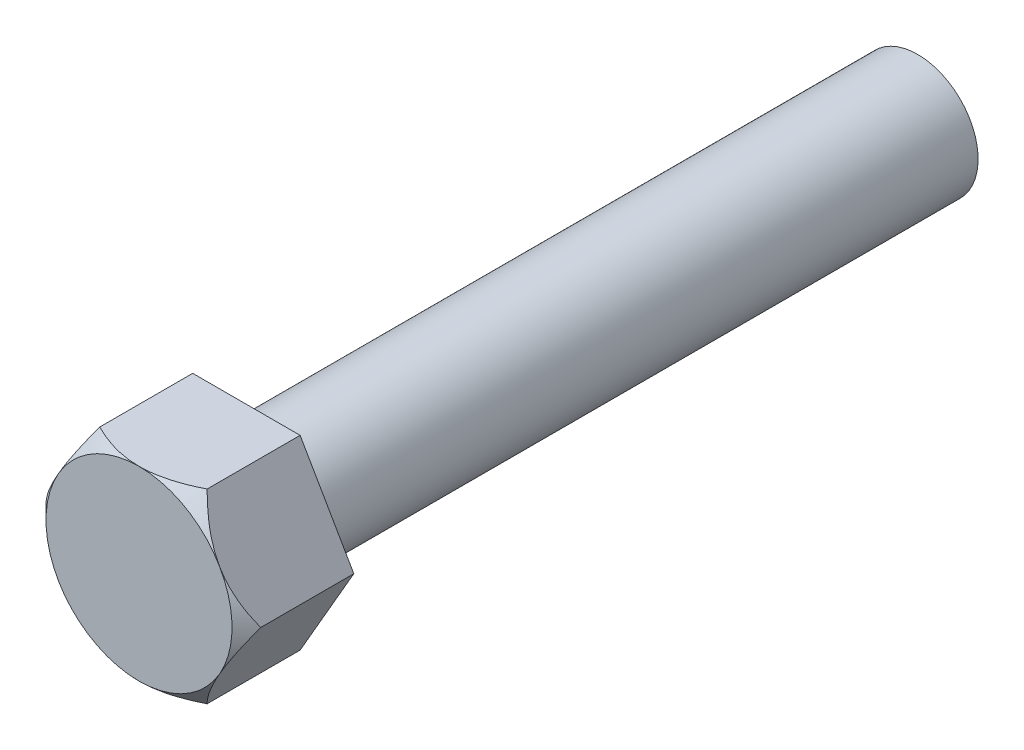
from build123d import *

# Parameters (mm, degrees)
BOSS_EXTRUDE1_DEPTH = 4
SKETCH2_OUTSIDE_W   = 20.262
SKETCH2_OUTSIDE_H   = 19.19
SKETCH2_OUTSIDE_R   = 3.464101615
CUT_EXTRUDE1_DEPTH  = 4
CUT_EXTRUDE1_DRAFT  = -45
SKETCH3_R           = 2.25
BOSS_EXTRUDE2_DEPTH = 25


with BuildPart() as part:
    # Sketch1 → Boss-Extrude1 (new body)
    with BuildSketch(Plane.XY):
        Polygon((-2, 3.464101615), (-4, 0), (-2, -3.464101615), (2, -3.464101615), (4, 0), (2, 3.464101615), align=None)
    extrude(amount=BOSS_EXTRUDE1_DEPTH)


with BuildPart() as cut_extrude1_tool:
    # Sketch2 outside → Cut-Extrude1 (with draft: the straight prism first)
    with BuildSketch(Plane.XY.offset(4)):
        Rectangle(SKETCH2_OUTSIDE_W, SKETCH2_OUTSIDE_H)
        Circle(SKETCH2_OUTSIDE_R, mode=Mode.SUBTRACT)
    extrude(amount=-CUT_EXTRUDE1_DEPTH)
    # Cut-Extrude1: the draft: its side faces are tilted about the plane it starts from
    cut_extrude1_sides = [cut_extrude1_tool.faces().sort_by_distance(p)[0] for p in [
        (0, -9.595, 2),
        (10.131, 0, 2),
        (0, 9.595, 2),
        (-10.131, 0, 2),
        (-3.464101615, 0, 2),
    ]]
    draft(cut_extrude1_sides, Plane.XY.offset(4), CUT_EXTRUDE1_DRAFT)


with BuildPart() as part_1:
    add(part.part)

    # Cut-Extrude1: cut by cut_extrude1_tool
    add(cut_extrude1_tool.part, mode=Mode.SUBTRACT)

    # Sketch3 → Boss-Extrude2 (add)
    with BuildSketch(Plane(origin=(0, 0, 0), x_dir=(-1, 0, 0), z_dir=(0, 0, -1))):
        Circle(SKETCH3_R)
    extrude(amount=BOSS_EXTRUDE2_DEPTH)


solid = part_1.part
